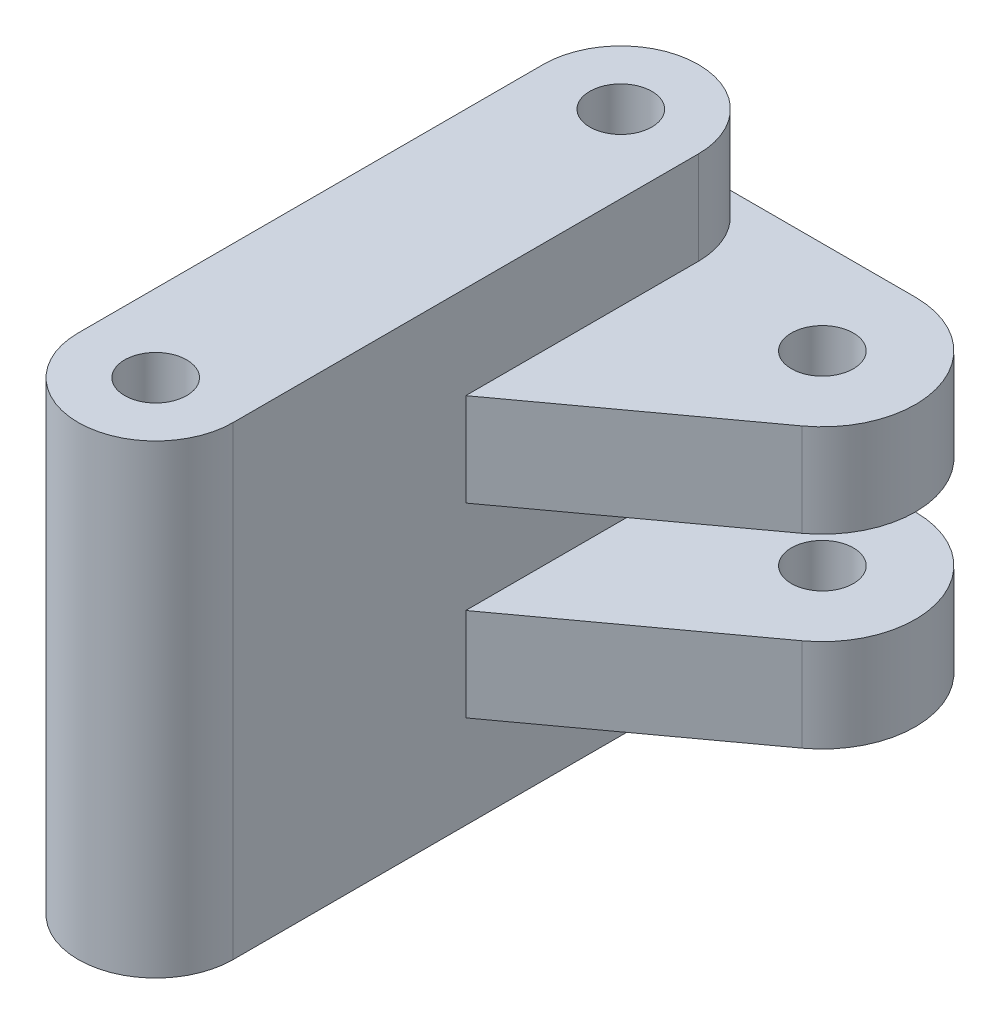
from build123d import *

# Parameters (mm, degrees)
CROQUIS1_R              = 1
SALIENTE_EXTRUIR1_DEPTH = 15
SALIENTE_EXTRUIR2_START = -3
CROQUIS2_R              = 1
SALIENTE_EXTRUIR2_DEPTH = 3
CROQUIS3_R              = 1
SALIENTE_EXTRUIR3_DEPTH = 3


with BuildPart() as part:
    # Croquis1 → Saliente-Extruir1 (new body)
    with BuildSketch(Plane(origin=(0, 0, 0), x_dir=(1, 0, 0), z_dir=(0, 1, 0))):
        with BuildLine():
            Line((-2.5, -7.5), (-2.5, 7.5))
            ThreePointArc((-2.5, 7.5), (0, 10), (2.5, 7.5))
            Line((2.5, 7.5), (2.5, -7.5))
            ThreePointArc((2.5, -7.5), (0, -10), (-2.5, -7.5))
        make_face()
        with Locations(Location((0, 7.5, 0), (0, 0, 270))):
            Circle(CROQUIS1_R, mode=Mode.SUBTRACT)
        with Locations(Location((0, -7.5, 0), (0, 0, 270))):
            Circle(CROQUIS1_R, mode=Mode.SUBTRACT)
    extrude(amount=SALIENTE_EXTRUIR1_DEPTH)

    # Croquis2 → Saliente-Extruir2 (add)
    with BuildSketch(Plane(origin=(0, 6, 0), x_dir=(-1, 0, 0), z_dir=(0, 1, 0)).offset(SALIENTE_EXTRUIR2_START)):
        with BuildLine():
            Line((-2.5, -7.5), (-2.5, 0))
            Line((-2.5, 0), (-8.769008438, -4.577066004))
            ThreePointArc((-8.769008438, -4.577066004), (-9.852087129, -7.930375734), (-7, -10))
            Line((-7, -10), (0, -10))
            ThreePointArc((0, -10), (-1.767766953, -9.267766953), (-2.5, -7.5))
        make_face()
        with Locations(Location((-7, -7, 0), (0, 0, 90))):
            Circle(CROQUIS2_R, mode=Mode.SUBTRACT)
    extrude(amount=SALIENTE_EXTRUIR2_DEPTH)

    # Croquis3 → Saliente-Extruir3 (add)
    with BuildSketch(Plane(origin=(0, 9, 0), x_dir=(-1, 0, 0), z_dir=(0, 1, 0))):
        with BuildLine():
            Line((-7, -10), (0, -10))
            ThreePointArc((0, -10), (-1.767766953, -9.267766953), (-2.5, -7.5))
            Line((-2.5, -7.5), (-2.5, 0))
            Line((-2.5, 0), (-8.769008438, -4.577066004))
            ThreePointArc((-8.769008438, -4.577066004), (-9.852087129, -7.930375734), (-7, -10))
        make_face()
        with Locations(Location((-7, -7, 0), (0, 0, 90))):
            Circle(CROQUIS3_R, mode=Mode.SUBTRACT)
    extrude(amount=SALIENTE_EXTRUIR3_DEPTH)


solid = part.part
